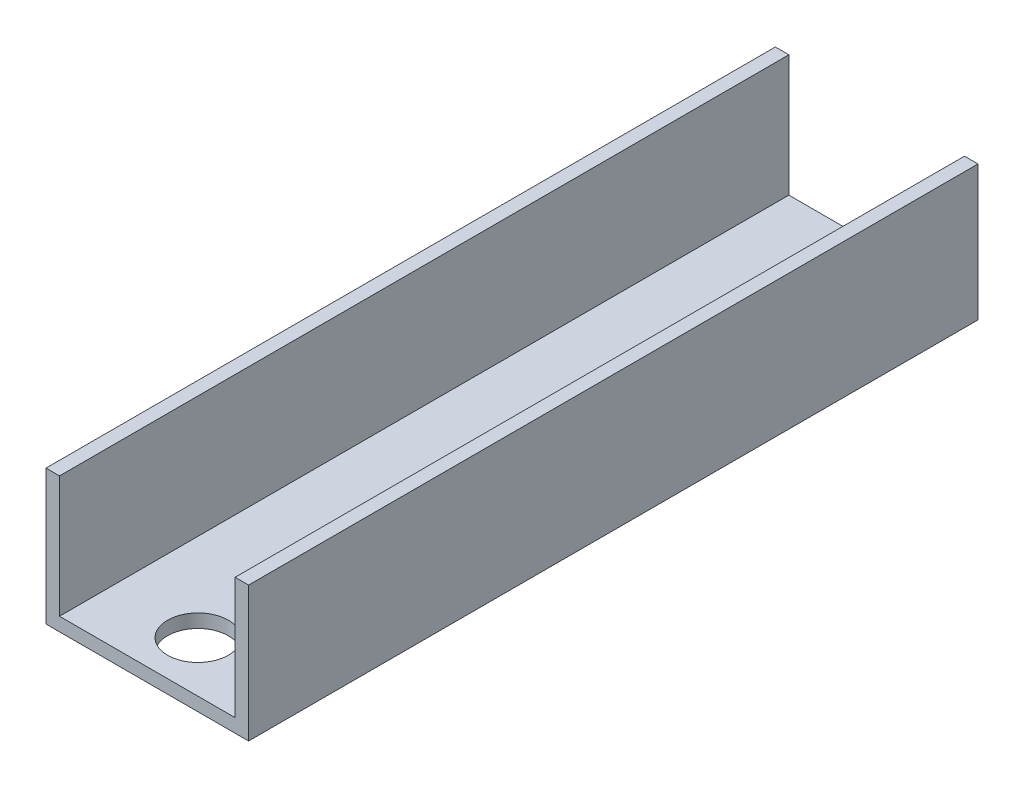
from build123d import *

# Parameters (mm, degrees)
EXTRUDE_1_DEPTH     = 54
SKETCH_2_R          = 2.25
CUT_EXTRUDE_1_DEPTH = 5


with BuildPart() as part:
    # Эскиз1 → Вытянуть1 (new body)
    with BuildSketch(Plane.XY):
        Polygon((-6.5, 10), (-6.5, 1), (6.5, 1), (6.5, 10), (7.5, 10), (7.5, 0), (-7.5, 0), (-7.5, 10), align=None)
    extrude(amount=EXTRUDE_1_DEPTH)

    # Эскиз2 → Вырез-Вытянуть1 (cut)
    with BuildSketch(Plane(origin=(0, 1, 0), x_dir=(1, 0, 0), z_dir=(0, 1, 0))):
        with Locations(Location((0, -3.75, 0), (0, 0, 270))):
            Circle(SKETCH_2_R)
        with Locations(Location((0, -50.25, 0), (0, 0, 270))):
            Circle(SKETCH_2_R)
    extrude(amount=-CUT_EXTRUDE_1_DEPTH, mode=Mode.SUBTRACT)


solid = part.part
